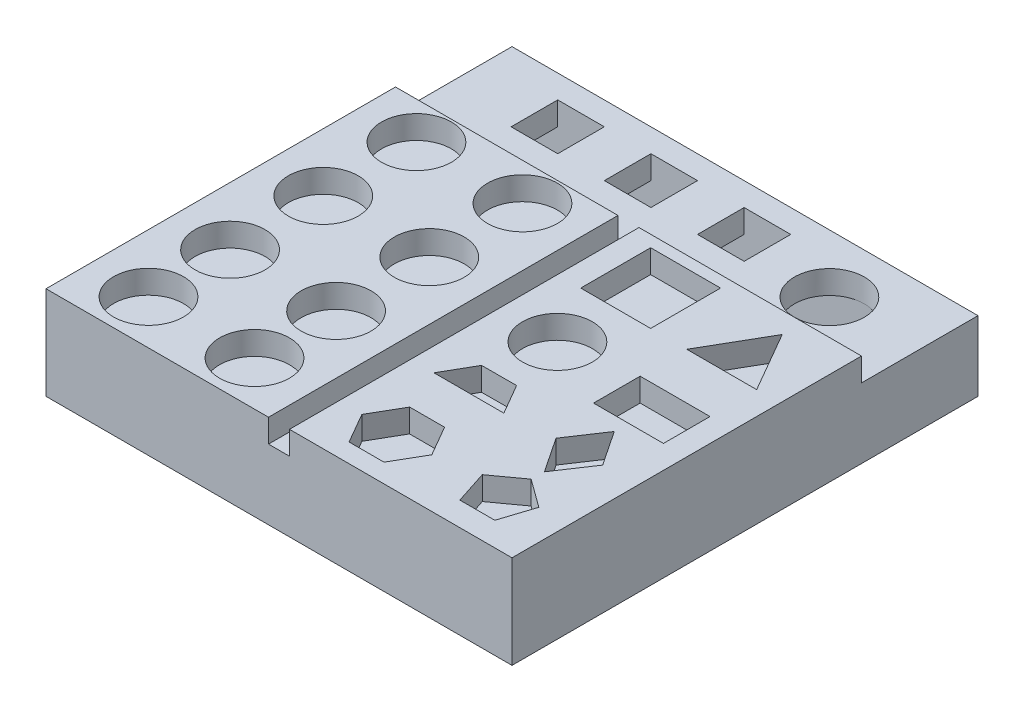
from build123d import *

# Parameters (mm, degrees)
CROQUIS1_W              = 200
CROQUIS1_H              = 200
SALIENTE_EXTRUIR1_DEPTH = 10
CROQUIS2_W              = 95.5
CROQUIS2_H              = 150
SALIENTE_EXTRUIR2_DEPTH = 10
CROQUIS3_R              = 15
CROQUIS3_W              = 20
CROQUIS3_H              = 20
CORTAR_EXTRUIR1_DEPTH   = 284.019433962
CROQUIS4_W              = 200
CROQUIS4_H              = 200
CROQUIS4_W_2            = 180
CROQUIS4_H_2            = 180
SALIENTE_EXTRUIR3_DEPTH = 20
CROQUIS6_R              = 2.5
CORTAR_EXTRUIR2_DEPTH   = 15
CROQUIS7_R              = 15
CORTAR_EXTRUIR3_DEPTH   = 10
CROQUIS8_R              = 15
CROQUIS8_W              = 30
CROQUIS8_H              = 30
CROQUIS8_H_2            = 20
CORTAR_EXTRUIR4_DEPTH   = 10


with BuildPart() as part:
    # Croquis1 → Saliente-Extruir1 (new body)
    with BuildSketch(Plane(origin=(0, 0, 0), x_dir=(1, 0, 0), z_dir=(0, 1, 0))):
        with Locations((-100, 100)):
            Rectangle(CROQUIS1_W, CROQUIS1_H)
    extrude(amount=SALIENTE_EXTRUIR1_DEPTH)

    # Croquis2 → Saliente-Extruir2 (add)
    with BuildSketch(Plane(origin=(0, 10, 0), x_dir=(1, 0, 0), z_dir=(0, 1, 0))):
        with Locations((-47.75, 75)):
            Rectangle(CROQUIS2_W, CROQUIS2_H)
        with Locations((-152.25, 75)):
            Rectangle(CROQUIS2_W, CROQUIS2_H)
    extrude(amount=SALIENTE_EXTRUIR2_DEPTH)

    # Croquis3 → Cortar-Extruir1 (cut, through all)
    with BuildSketch(Plane(origin=(0, 10, 0), x_dir=(1, 0, 0), z_dir=(0, 1, 0))):
        with Locations(Location((-38.780765976, 175, 0), (0, 0, 270))):
            Circle(CROQUIS3_R)
        with Locations((-160.375957062, 180)):
            Rectangle(CROQUIS3_W, CROQUIS3_H)
        with Locations((-120.375957062, 180)):
            Rectangle(CROQUIS3_W, CROQUIS3_H)
        with Locations((-80.375957062, 180)):
            Rectangle(CROQUIS3_W, CROQUIS3_H)
    extrude(amount=-CORTAR_EXTRUIR1_DEPTH, mode=Mode.SUBTRACT)

    # Croquis4 → Saliente-Extruir3 (add)
    with BuildSketch(Plane(origin=(0, 0, 0), x_dir=(-1, 0, 0), z_dir=(0, -1, 0))):
        with Locations((100, 100)):
            Rectangle(CROQUIS4_W, CROQUIS4_H)
        with Locations((100, 100)):
            Rectangle(CROQUIS4_W_2, CROQUIS4_H_2, mode=Mode.SUBTRACT)
    extrude(amount=SALIENTE_EXTRUIR3_DEPTH)

    # Croquis6 → Cortar-Extruir2 (cut)
    with BuildSketch(Plane(origin=(0, -20, 0), x_dir=(-1, 0, 0), z_dir=(0, -1, 0))):
        with Locations(Location((195, 5, 0), (0, 0, 90))):
            Circle(CROQUIS6_R)
        with Locations(Location((5, 5, 0), (0, 0, 90))):
            Circle(CROQUIS6_R)
        with Locations(Location((5, 195, 0), (0, 0, 90))):
            Circle(CROQUIS6_R)
        with Locations(Location((195, 195, 0), (0, 0, 90))):
            Circle(CROQUIS6_R)
    extrude(amount=-CORTAR_EXTRUIR2_DEPTH, mode=Mode.SUBTRACT)

    # Croquis7 → Cortar-Extruir3 (cut)
    with BuildSketch(Plane(origin=(0, 20, 0), x_dir=(1, 0, 0), z_dir=(0, 1, 0))):
        with Locations(Location((-175, 134, 0), (0, 0, 270))):
            Circle(CROQUIS7_R)
        with Locations(Location((-129.5, 134, 0), (0, 0, 270))):
            Circle(CROQUIS7_R)
        with Locations(Location((-175, 94, 0), (0, 0, 270))):
            Circle(CROQUIS7_R)
        with Locations(Location((-129.5, 94, 0), (0, 0, 270))):
            Circle(CROQUIS7_R)
        with Locations(Location((-175, 54, 0), (0, 0, 270))):
            Circle(CROQUIS7_R)
        with Locations(Location((-129.5, 54, 0), (0, 0, 270))):
            Circle(CROQUIS7_R)
        with Locations(Location((-175, 19, 0), (0, 0, 270))):
            Circle(CROQUIS7_R)
        with Locations(Location((-129.5, 19, 0), (0, 0, 270))):
            Circle(CROQUIS7_R)
    extrude(amount=-CORTAR_EXTRUIR3_DEPTH, mode=Mode.SUBTRACT)

    # Croquis8 → Cortar-Extruir4 (cut)
    with BuildSketch(Plane(origin=(0, 20, 0), x_dir=(1, 0, 0), z_dir=(0, 1, 0))):
        with Locations(Location((-70.5, 90, 0), (0, 0, 270))):
            Circle(CROQUIS8_R)
        with Locations((-70.5, 130)):
            Rectangle(CROQUIS8_W, CROQUIS8_H)
        Polygon((-40, 115), (-10, 115), (-25, 140.980762114), align=None)
        Polygon((-85.5, 52.009587992), (-55.5, 52.009587992), (-63.049173048, 65.016851393), (-78.04913439, 64.982796557), align=None)
        with Locations((-25, 85)):
            Rectangle(CROQUIS8_W, CROQUIS8_H_2)
        Polygon((-25, 68.896042606), (-35, 53.896042606), (-25, 38.905718571), (-15, 53.896042606), align=None)
        Polygon((-55.5, 21.068183762), (-63, 34.058564819), (-78, 34.058564819), (-85.5, 21.068183762), (-78, 8.077802706), (-63, 8.077802706), align=None)
        Polygon((-25.135254916, 33.338916583), (-37.270509831, 24.522137799), (-32.635254916, 10.256290054), (-17.635254916, 10.256290054), (-13, 24.522137799), align=None)
    extrude(amount=-CORTAR_EXTRUIR4_DEPTH, mode=Mode.SUBTRACT)


solid = part.part
